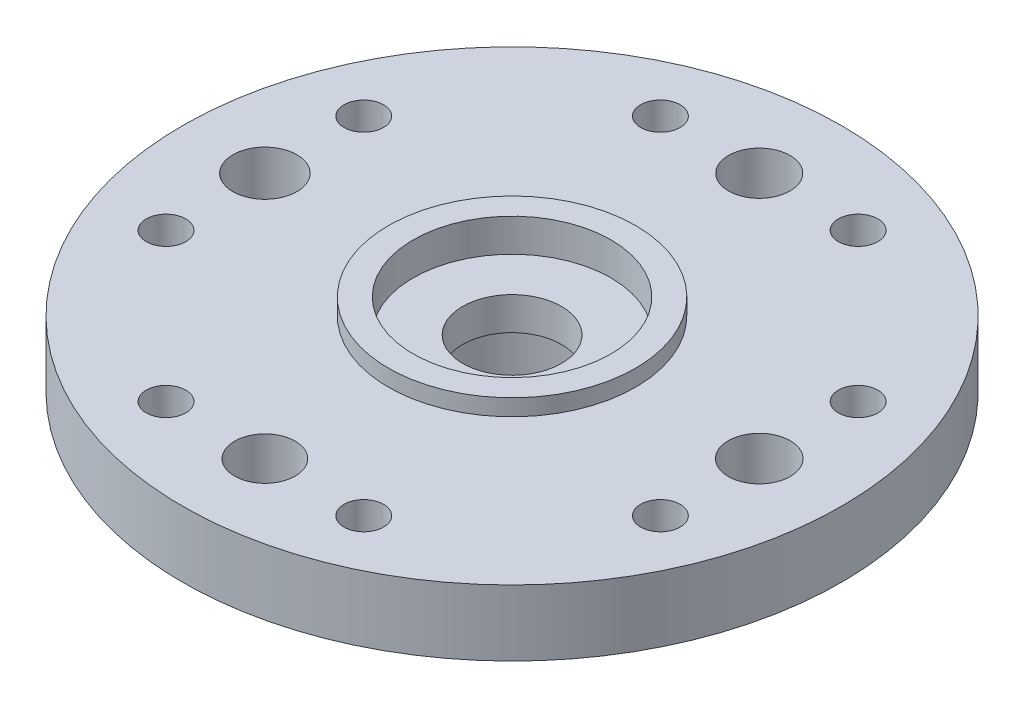
from build123d import *

# Parameters (mm, degrees)
SKETCH1_R               = 0.6
CUT_EXTRUDE1_DEPTH      = 2
CIRPATTERN1_COUNT       = 4
ESQUISSE2_R             = 0.934495928
ESQUISSE2_R_2           = 0.971023647
ESQUISSE2_R_3           = 0.919680735
ESQUISSE2_R_4           = 0.940854572
ENL_V_MAT_EXTRU_1_DEPTH = 15.361406616


with BuildPart() as part:
    # Esquisse1 → Révolution1 (revolve)
    with BuildSketch(Plane.XY, mode=Mode.PRIVATE) as r_volution1_sk:
        Polygon((2.75, 0), (2.75, 3), (1.5, 3), (1.5, 4), (3, 4), (3, 5), (3.75, 5), (3.75, 4.5), (10, 4.5), (10, 2.5), (4.5, 2.5), (4.5, 0), align=None)
    revolve(r_volution1_sk.sketch.rotate(Axis((0, 0, 0), (0, 1, 0)), 90), axis=Axis((0, 0, 0), (0, 1, 0)))

    # Sketch1 → Cut-Extrude1 (cut)
    with BuildSketch(Plane(origin=(0, 4.5, 0), x_dir=(1, 0, 0), z_dir=(0, 1, 0))):
        with Locations(Location((0, 7.5, 0), (0, 0, 270))):
            Circle(SKETCH1_R)
        with Locations(Location((3, 7.5, 0), (0, 0, 270))):
            Circle(SKETCH1_R)
        with Locations(Location((-3, 7.5, 0), (0, 0, 90))):
            Circle(SKETCH1_R)
    cut_extrude1 = extrude(amount=-CUT_EXTRUDE1_DEPTH, mode=Mode.SUBTRACT)

    # CirPattern1: Cut-Extrude1 ×4 about axis
    cirpattern1_axis = Axis((0, 0, 0), (0, 1, 0))
    for i in range(1, CIRPATTERN1_COUNT):
        add(cut_extrude1.rotate(cirpattern1_axis, i * 360 / CIRPATTERN1_COUNT), mode=Mode.SUBTRACT)

    # Esquisse2 → Enlèv. mat.-Extru.1 (cut, through all)
    with BuildSketch(Plane.XZ.offset(-2.5)):
        with Locations(Location((0, -7.5, 0), (0, 0, 270))):
            Circle(ESQUISSE2_R)
        with Locations(Location((-7.5, 0, 0), (0, 0, 270))):
            Circle(ESQUISSE2_R_2)
        with Locations(Location((0, 7.5, 0), (0, 0, 270))):
            Circle(ESQUISSE2_R_3)
        with Locations(Location((7.5, 0, 0), (0, 0, 270))):
            Circle(ESQUISSE2_R_4)
    extrude(amount=-ENL_V_MAT_EXTRU_1_DEPTH, mode=Mode.SUBTRACT)


solid = part.part
